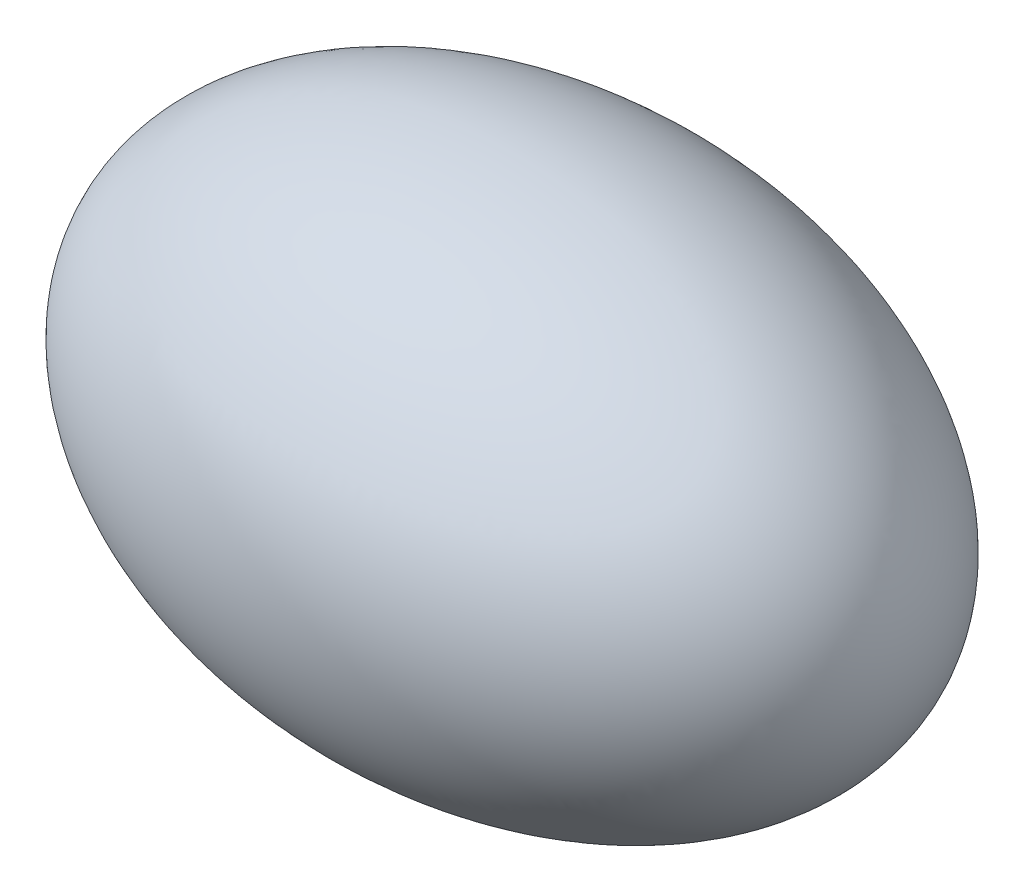
from build123d import *


with BuildPart() as part:
    # Sketch1 → Revolve2 (revolve)
    with BuildSketch(Plane.XY):
        with BuildLine():
            Line((-129.54, 0), (129.54, 0))
            add(Edge.make_bspline(
                [(129.54, 0), (129.54, 85.09), (0, 85.09), (-129.54, 85.09), (-129.54, 0)],
                knots=[0, 0, 0, 1.570796327, 1.570796327, 3.141592654, 3.141592654, 3.141592654], degree=2, weights=[1, 0.707106781, 1, 0.707106781, 1]))
        make_face()
    revolve(axis=Axis((-129.54, 0, 0), (1, 0, 0)))


solid = part.part
